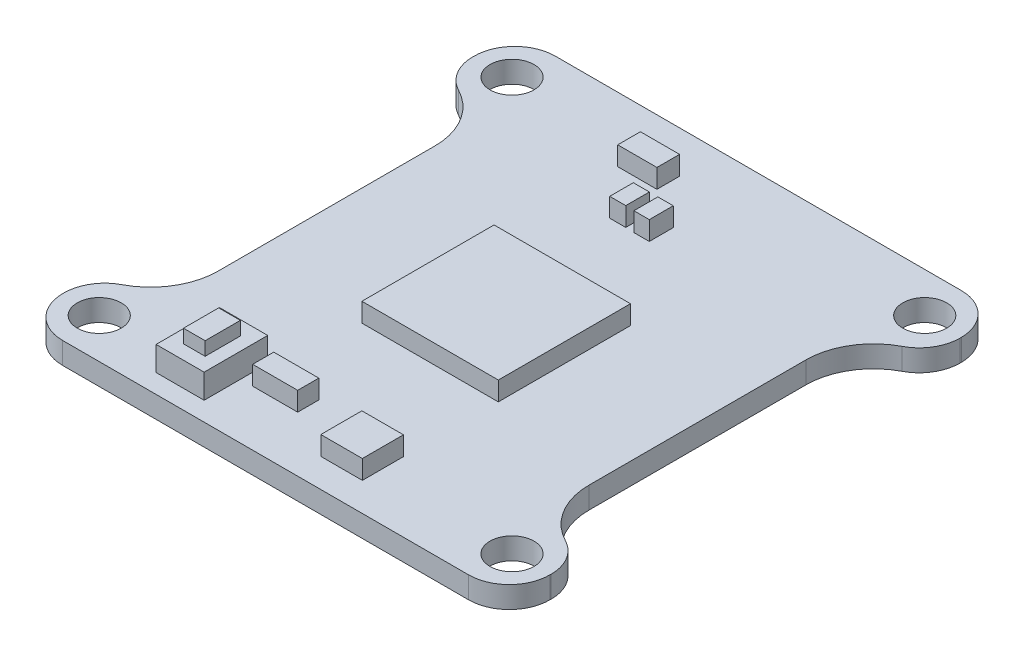
from build123d import *

# Parameters (mm, degrees)
SKETCH1_R             = 1.625
PCB_DEPTH             = 1.6
SKETCH2_W             = 10.080807645
SKETCH2_H             = 9.766872459
SKETCH2_W_2           = 3.069588487
SKETCH2_H_2           = 3.0347068
SKETCH2_W_3           = 2.89518005
SKETCH2_H_3           = 1.674320993
SKETCH2_W_4           = 1.18597737
SKETCH2_H_4           = 1.744084367
SKETCH2_W_5           = 1.137538121
SKETCH2_H_5           = 1.77179178
SKETCH2_W_6           = 3.325937142
SKETCH2_H_6           = 1.560165557
TOP_COMPONENTS_DEPTH  = 1.4
FILLET1_R             = 3
FILLET2_R             = 5
SKETCH3_W             = 3.174233549
SKETCH3_H             = 2.964943425
SKETCH3_W_2           = 3.104470174
SKETCH3_H_2           = 1.534794244
SKETCH3_W_3           = 2.999825112
SKETCH3_H_3           = 1.569675931
SKETCH3_W_4           = 1.255740744
SKETCH3_H_4           = 2.895180051
SKETCH3_W_5           = 1.151095683
SKETCH3_H_5           = 2.058019554
REAR_COMPONENTS_DEPTH = 1.4
SKETCH4_W             = 3.55
SKETCH4_H             = 4.7
BUTTON_BASE_DEPTH     = 1.8
SKETCH5_W             = 1.6
SKETCH5_H             = 2.6
BUTTON_TIP_DEPTH      = 1


with BuildPart() as part:
    # Sketch1 → PCB (new body)
    with BuildSketch(Plane(origin=(0, 0, 0), x_dir=(1, 0, 0), z_dir=(0, 1, 0))):
        Polygon((-18, 18.2), (-18, 12.1), (-13.7, 12.1), (-13.7, -12.1), (-18, -12.1), (-18, -18.2), (18, -18.2), (18, -12.1), (13.7, -12.1), (13.7, 12.1), (18, 12.1), (18, 18.2), align=None)
        with Locations(Location((15.25, -15.25, 0), (0, 0, 270))):
            Circle(SKETCH1_R, mode=Mode.SUBTRACT)
        with Locations(Location((15.25, 15.25, 0), (0, 0, 270))):
            Circle(SKETCH1_R, mode=Mode.SUBTRACT)
        with Locations(Location((-15.25, 15.25, 0), (0, 0, 270))):
            Circle(SKETCH1_R, mode=Mode.SUBTRACT)
        with Locations(Location((-15.25, -15.25, 0), (0, 0, 270))):
            Circle(SKETCH1_R, mode=Mode.SUBTRACT)
    extrude(amount=PCB_DEPTH)

    # Sketch2 → Top components (add)
    with BuildSketch(Plane(origin=(0, 1.6, 0), x_dir=(1, 0, 0), z_dir=(0, 1, 0))):
        with Locations((-0.017440844, -1.151095683)):
            Rectangle(SKETCH2_W, SKETCH2_H)
        with Locations((3.488168735, -14.56310447)):
            Rectangle(SKETCH2_W_2, SKETCH2_H_2)
        with Locations((-4.168361639, 14.266610128)):
            Rectangle(SKETCH2_W_3, SKETCH2_H_3)
        with Locations((-2.023137867, 10.708678018)):
            Rectangle(SKETCH2_W_4, SKETCH2_H_4)
        with Locations((-0.233509749, 10.694824311)):
            Rectangle(SKETCH2_W_5, SKETCH2_H_5)
        with Locations((-3.394876095, -13.324858297)):
            Rectangle(SKETCH2_W_6, SKETCH2_H_6)
    extrude(amount=TOP_COMPONENTS_DEPTH)

    # Fillet1
    fillet1_edges = [part.edges().sort_by_distance(p)[0] for p in [
        (-18, 0.8, 18.2),
        (-18, 0.8, 12.1),
        (-18, 0.8, -12.1),
        (-18, 0.8, -18.2),
        (18, 0.8, -18.2),
        (18, 0.8, -12.1),
        (18, 0.8, 12.1),
        (18, 0.8, 18.2),
    ]]
    fillet(fillet1_edges, radius=FILLET1_R)

    # Fillet2
    fillet2_edges = [part.edges().sort_by_distance(p)[0] for p in [
        (13.7, 0.8, -12.1),
        (13.7, 0.8, 12.1),
        (-13.7, 0.8, 12.1),
        (-13.7, 0.8, -12.1),
    ]]
    fillet(fillet2_edges, radius=FILLET2_R)

    # Sketch3 → Rear components (add)
    with BuildSketch(Plane.XZ):
        with Locations((-8.319282433, -14.318932658)):
            Rectangle(SKETCH3_W, SKETCH3_H)
        with Locations((-4.307888388, -14.127083378)):
            Rectangle(SKETCH3_W_2, SKETCH3_H_2)
        with Locations((3.662577172, 9.540141492)):
            Rectangle(SKETCH3_W_3, SKETCH3_H_3)
        with Locations((-4.150920795, 9.470378117)):
            Rectangle(SKETCH3_W_4, SKETCH3_H_4)
        with Locations((-1.552235088, -14.388696033)):
            Rectangle(SKETCH3_W_5, SKETCH3_H_5)
    extrude(amount=REAR_COMPONENTS_DEPTH)

    # Sketch4 → Button base (add)
    with BuildSketch(Plane(origin=(0, 1.6, 0), x_dir=(1, 0, 0), z_dir=(0, 1, 0))):
        with Locations((-7.725, -14.45)):
            Rectangle(SKETCH4_W, SKETCH4_H)
    extrude(amount=BUTTON_BASE_DEPTH)

    # Sketch5 → Button tip (add)
    with BuildSketch(Plane(origin=(0, 3.4, 0), x_dir=(1, 0, 0), z_dir=(0, 1, 0))):
        with Locations((-7.725, -14.45)):
            Rectangle(SKETCH5_W, SKETCH5_H)
    extrude(amount=BUTTON_TIP_DEPTH)


solid = part.part
